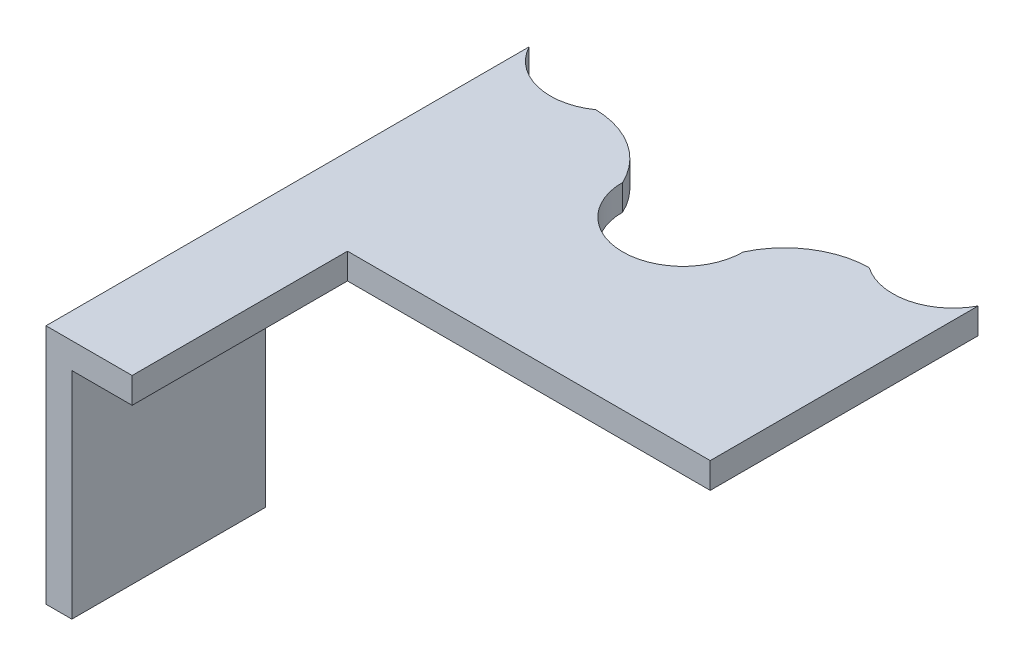
from build123d import *

# Parameters (mm, degrees)
BOSS_EXTRUDE1_DEPTH = 3
SKETCH3_W           = 10
SKETCH3_H           = 3
BOSS_EXTRUDE2_DEPTH = 25
SKETCH4_W           = 3
SKETCH4_H           = 22.5
BOSS_EXTRUDE3_DEPTH = 25


with BuildPart() as part:
    # Sketch2 → Boss-Extrude1 (new body)
    with BuildSketch(Plane(origin=(0, 0, 0), x_dir=(1, 0, 0), z_dir=(0, 1, 0))):
        with BuildLine():
            Line((26.055569119, 8.188046441), (26.055569119, -22.896953559))
            Line((26.055569119, -22.896953559), (-26.055569119, -22.896953559))
            Line((-26.055569119, -22.896953559), (-26.055569119, 8.188046441))
            ThreePointArc((-26.055569119, 8.188046441), (-21.514872246, 4.669726518), (-15.870079226, 5.73406431))
            ThreePointArc((-15.870079226, 5.73406431), (-10.616247764, 4.133629141), (-7, 0))
            ThreePointArc((-7, 0), (0, -7), (7, 0))
            ThreePointArc((7, 0), (10.616247764, 4.133629141), (15.870079226, 5.73406431))
            ThreePointArc((15.870079226, 5.73406431), (21.514872246, 4.669726518), (26.055569119, 8.188046441))
        make_face()
    extrude(amount=BOSS_EXTRUDE1_DEPTH)

    # Sketch3 → Boss-Extrude2 (add)
    with BuildSketch(Plane.XY.offset(22.896953559)):
        with Locations((-21.055569119, 1.5)):
            Rectangle(SKETCH3_W, SKETCH3_H)
    extrude(amount=BOSS_EXTRUDE2_DEPTH)

    # Sketch4 → Boss-Extrude3 (add)
    with BuildSketch(Plane.XZ):
        with Locations((-24.555569119, 36.646953559)):
            Rectangle(SKETCH4_W, SKETCH4_H)
    extrude(amount=BOSS_EXTRUDE3_DEPTH)


solid = part.part
